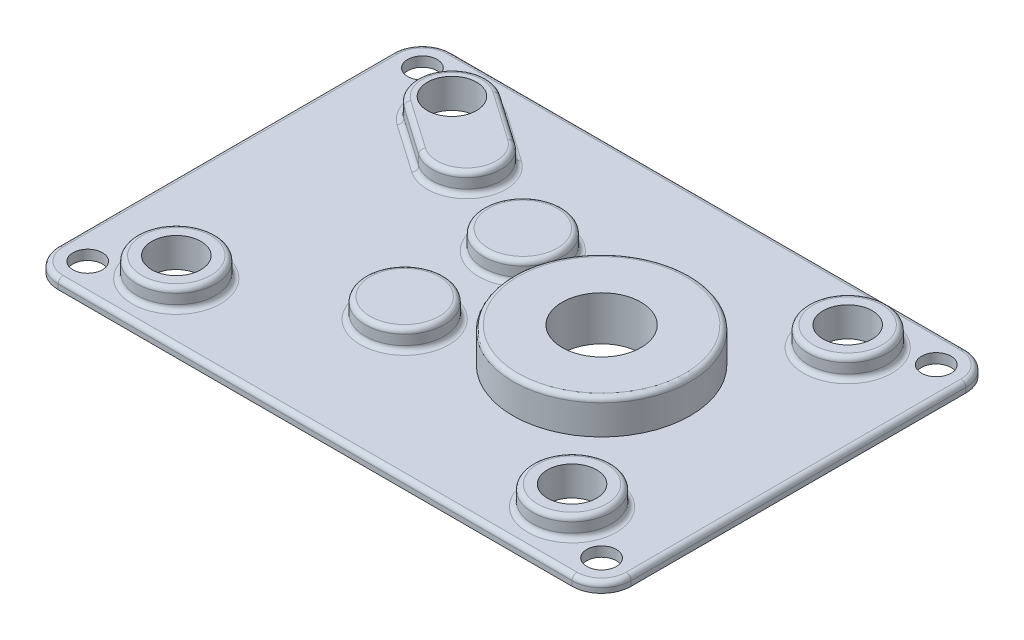
from build123d import *

# Parameters (mm, degrees)
BOSS_EXTRUDE1_DEPTH = 1
SKETCH2_R           = 2.5
SKETCH2_R_2         = 1.5
CUT_EXTRUDE3_DEPTH  = 2
BOSS_EXTRUDE3_START = 2
SKETCH2_6_R         = 2.5
SKETCH2_6_R_2       = 4
BOSS_EXTRUDE3_DEPTH = 2
FILLET1_R           = 0.5
SKETCH3_R           = 4
CUT_EXTRUDE4_DEPTH  = 2
BOSS_EXTRUDE4_START = 3.5
SKETCH3_3_R         = 9
SKETCH3_3_R_2       = 4
BOSS_EXTRUDE4_DEPTH = 3.5
FILLET2_R           = 0.5
FILLET3_R           = 0.5


with BuildPart() as part:
    # Sketch1 → Boss-Extrude1 (new body)
    with BuildSketch(Plane(origin=(0, 0, 0), x_dir=(1, 0, 0), z_dir=(0, 1, 0))):
        with BuildLine():
            Line((-26.1, 20), (26.1, 20))
            ThreePointArc((26.1, 20), (28.221320344, 19.121320344), (29.1, 17))
            Line((29.1, 17), (29.1, -17))
            ThreePointArc((29.1, -17), (28.221320344, -19.121320344), (26.1, -20))
            Line((26.1, -20), (-26.1, -20))
            ThreePointArc((-26.1, -20), (-28.221320344, -19.121320344), (-29.1, -17))
            Line((-29.1, -17), (-29.1, 17))
            ThreePointArc((-29.1, 17), (-28.221320344, 19.121320344), (-26.1, 20))
        make_face()
    extrude(amount=BOSS_EXTRUDE1_DEPTH)

    # Sketch2 → Cut-Extrude3 (cut)
    with BuildSketch(Plane(origin=(0, 1, 0), x_dir=(1, 0, 0), z_dir=(0, 1, 0))):
        with Locations((20.1, -14)):
            Circle(SKETCH2_R)
        with Locations((20.1, 14)):
            Circle(SKETCH2_R)
        with Locations((-20.1, -14)):
            Circle(SKETCH2_R)
        with Locations((-20.1, 14)):
            Circle(SKETCH2_R)
        with Locations((-26.1, -17)):
            Circle(SKETCH2_R_2)
        with Locations((-26.1, 17)):
            Circle(SKETCH2_R_2)
        with Locations((26.1, 17)):
            Circle(SKETCH2_R_2)
        with Locations((26.1, -17)):
            Circle(SKETCH2_R_2)
    extrude(amount=-CUT_EXTRUDE3_DEPTH, mode=Mode.SUBTRACT)

    # Sketch2<6> → Boss-Extrude3 (add)
    # profile 1 of 6: a face of its own
    with BuildSketch(Plane(origin=(0, 1, 0), x_dir=(1, 0, 0), z_dir=(0, 1, 0)).offset(BOSS_EXTRUDE3_START)):
        with BuildLine():
            Line((-13.176166692, 13.442745727), (-18.099600047, 16.87200279))
            ThreePointArc((-18.099600047, 16.87200279), (-22.97200279, 16.000399953), (-22.100399953, 11.12799721))
            Line((-22.100399953, 11.12799721), (-17.176966599, 7.698740147))
            ThreePointArc((-17.176966599, 7.698740147), (-12.304563855, 8.570342984), (-13.176166692, 13.442745727))
        make_face()
        with Locations((-20.1, 14)):
            Circle(SKETCH2_6_R, mode=Mode.SUBTRACT)
    # profile 2 of 6: a face of its own
    with BuildSketch(Plane(origin=(0, 1, 0), x_dir=(1, 0, 0), z_dir=(0, 1, 0)).offset(BOSS_EXTRUDE3_START)):
        with Locations((20.1, -14)):
            Circle(SKETCH2_6_R_2)
        with Locations((20.1, -14)):
            Circle(SKETCH2_6_R, mode=Mode.SUBTRACT)
    # profile 3 of 6: a face of its own
    with BuildSketch(Plane(origin=(0, 1, 0), x_dir=(1, 0, 0), z_dir=(0, 1, 0)).offset(BOSS_EXTRUDE3_START)):
        with Locations((20.1, 14)):
            Circle(SKETCH2_6_R_2)
        with Locations((20.1, 14)):
            Circle(SKETCH2_6_R, mode=Mode.SUBTRACT)
    # profile 4 of 6: a face of its own
    with BuildSketch(Plane(origin=(0, 1, 0), x_dir=(1, 0, 0), z_dir=(0, 1, 0)).offset(BOSS_EXTRUDE3_START)):
        with Locations((-20.1, -14)):
            Circle(SKETCH2_6_R_2)
        with Locations((-20.1, -14)):
            Circle(SKETCH2_6_R, mode=Mode.SUBTRACT)
    # profile 5 of 6: a face of its own
    with BuildSketch(Plane(origin=(0, 1, 0), x_dir=(1, 0, 0), z_dir=(0, 1, 0)).offset(BOSS_EXTRUDE3_START)):
        with Locations((-4.9, -6)):
            Circle(SKETCH2_6_R_2)
    # profile 6 of 6: a face of its own
    with BuildSketch(Plane(origin=(0, 1, 0), x_dir=(1, 0, 0), z_dir=(0, 1, 0)).offset(BOSS_EXTRUDE3_START)):
        with Locations((-4.9, 6)):
            Circle(SKETCH2_6_R_2)
    extrude(amount=-BOSS_EXTRUDE3_DEPTH)

    # Fillet1
    fillet1_edges = [part.edges().sort_by_distance(p)[0] for p in [
        (-28.221320344, 1, 19.121320344),
        (-29.1, 1, 0),
        (-28.221320344, 1, -19.121320344),
        (0, 1, -20),
        (28.221320344, 1, -19.121320344),
        (29.1, 1, 0),
        (28.221320344, 1, 19.121320344),
        (0, 1, 20),
        (-12.304563855, 3, -8.570342984),
        (-15.637883369, 3, -15.157374259),
        (-22.97200279, 3, -16.000399953),
        (16.1, 3, -14),
        (-19.638683276, 3, -9.413368678),
        (-8.9, 3, -6),
        (-8.9, 3, 6),
        (-24.1, 3, 14),
        (16.1, 3, 14),
    ]]
    fillet(fillet1_edges, radius=FILLET1_R)

    # Sketch3 → Cut-Extrude4 (cut)
    with BuildSketch(Plane(origin=(0, 1, 0), x_dir=(1, 0, 0), z_dir=(0, 1, 0))):
        with Locations((9.1, 0)):
            Circle(SKETCH3_R)
    extrude(amount=-CUT_EXTRUDE4_DEPTH, mode=Mode.SUBTRACT)

    # Sketch3<3> → Boss-Extrude4 (add)
    with BuildSketch(Plane(origin=(0, 1, 0), x_dir=(1, 0, 0), z_dir=(0, 1, 0)).offset(BOSS_EXTRUDE4_START)):
        with Locations((9.1, 0)):
            Circle(SKETCH3_3_R)
        with Locations((9.1, 0)):
            Circle(SKETCH3_3_R_2, mode=Mode.SUBTRACT)
    extrude(amount=-BOSS_EXTRUDE4_DEPTH)

    # Fillet2
    fillet2_edges = [part.edges().sort_by_distance(p)[0] for p in [
        (0.1, 4.5, 0),
    ]]
    fillet(fillet2_edges, radius=FILLET2_R)

    # Fillet3
    fillet3_edges = [part.edges().sort_by_distance(p)[0] for p in [
        (-12.304563855, 1, -8.570342984),
        (-15.637883369, 1, -15.157374259),
        (-22.97200279, 1, -16.000399953),
        (-24.1, 1, 14),
        (-19.638683276, 1, -9.413368678),
        (16.1, 1, -14),
        (16.1, 1, 14),
        (-8.9, 1, -6),
        (-8.9, 1, 6),
    ]]
    fillet(fillet3_edges, radius=FILLET3_R)


solid = part.part
